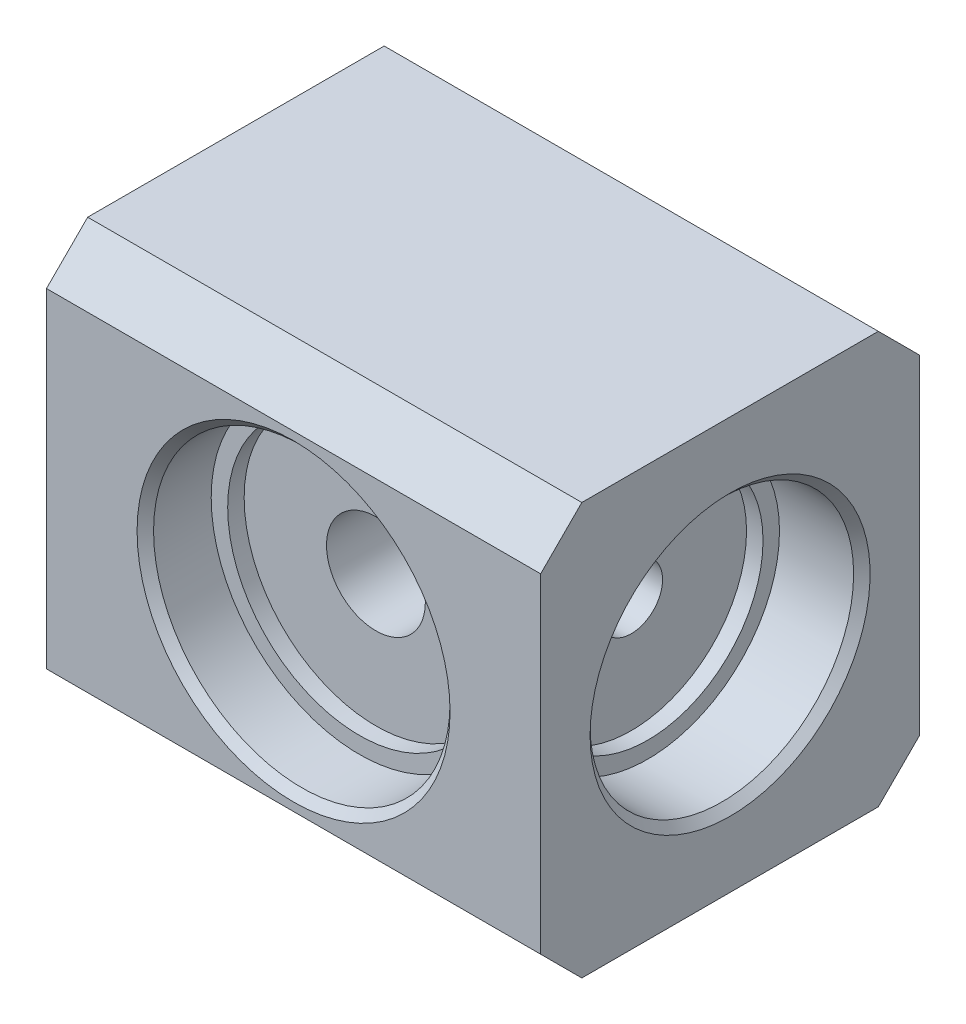
from build123d import *

# Parameters (mm, degrees)
SKETCH1_W           = 30
SKETCH1_H           = 23
BOSS_EXTRUDE1_DEPTH = 25
SKETCH2_R           = 8
CUT_EXTRUDE1_DEPTH  = 5
SKETCH3_R           = 7
CUT_EXTRUDE2_DEPTH  = 1
SKETCH4_R           = 1.9
CUT_EXTRUDE3_DEPTH  = 4
SKETCH6_R           = 9
CUT_EXTRUDE4_DEPTH  = 4
SKETCH7_R           = 3
CUT_EXTRUDE8_DEPTH  = 19
SKETCH12_R          = 8
CUT_EXTRUDE9_DEPTH  = 1
CHAMFER1_SIZE       = 2.5
CHAMFER2_SIZE       = 0.5


with BuildPart() as part:
    # Sketch1 → Boss-Extrude1 (new body)
    with BuildSketch(Plane(origin=(0, 0, 0), x_dir=(1, 0, 0), z_dir=(0, 1, 0))):
        with Locations((15, 1)):
            Rectangle(SKETCH1_W, SKETCH1_H)
    extrude(amount=BOSS_EXTRUDE1_DEPTH)

    # Sketch2 → Cut-Extrude1 (cut)
    with BuildSketch(Plane(origin=(30, 0, 0), x_dir=(0, 0, -1), z_dir=(1, 0, 0))):
        with Locations((1, 12.5)):
            Circle(SKETCH2_R)
    cut_extrude1 = extrude(amount=-CUT_EXTRUDE1_DEPTH, mode=Mode.SUBTRACT)

    # Sketch3 → Cut-Extrude2 (cut)
    with BuildSketch(Plane(origin=(25, 0, 0), x_dir=(0, 0, -1), z_dir=(1, 0, 0))):
        with Locations((1, 12.5)):
            Circle(SKETCH3_R)
    cut_extrude2 = extrude(amount=-CUT_EXTRUDE2_DEPTH, mode=Mode.SUBTRACT)

    # Sketch4 → Cut-Extrude3 (cut)
    with BuildSketch(Plane(origin=(24, 0, 0), x_dir=(0, 0, -1), z_dir=(1, 0, 0))):
        with Locations((1, 12.5)):
            Circle(SKETCH4_R)
    cut_extrude3 = extrude(amount=-CUT_EXTRUDE3_DEPTH, mode=Mode.SUBTRACT)

    # Mirror1: Cut-Extrude1, Cut-Extrude2, Cut-Extrude3 across plane
    add(cut_extrude1.mirror(Plane(origin=(15, 25, 0), x_dir=(0, 0, 1), z_dir=(1, 0, 0))), mode=Mode.SUBTRACT)
    add(cut_extrude2.mirror(Plane(origin=(15, 25, 0), x_dir=(0, 0, 1), z_dir=(1, 0, 0))), mode=Mode.SUBTRACT)
    add(cut_extrude3.mirror(Plane(origin=(15, 25, 0), x_dir=(0, 0, 1), z_dir=(1, 0, 0))), mode=Mode.SUBTRACT)

    # Sketch6 → Cut-Extrude4 (cut)
    with BuildSketch(Plane.XY.offset(10.5)):
        with Locations((15, 12.5)):
            Circle(SKETCH6_R)
    cut_extrude4 = extrude(amount=-CUT_EXTRUDE4_DEPTH, mode=Mode.SUBTRACT)

    # Sketch7 → Cut-Extrude8 (cut)
    with BuildSketch(Plane.XY.offset(6.5)):
        with Locations((15, 12.5)):
            Circle(SKETCH7_R)
    extrude(amount=-CUT_EXTRUDE8_DEPTH, mode=Mode.SUBTRACT)

    # Sketch12 → Cut-Extrude9 (cut)
    with BuildSketch(Plane.XY.offset(6.5)):
        with Locations((15, 12.5)):
            Circle(SKETCH12_R)
    cut_extrude9 = extrude(amount=-CUT_EXTRUDE9_DEPTH, mode=Mode.SUBTRACT)

    # Mirror4: Cut-Extrude4, Cut-Extrude9 across plane
    add(cut_extrude4.mirror(Plane(origin=(15, 0, -1), x_dir=(1, 0, 0), z_dir=(0, 0, 1))), mode=Mode.SUBTRACT)
    add(cut_extrude9.mirror(Plane(origin=(15, 0, -1), x_dir=(1, 0, 0), z_dir=(0, 0, 1))), mode=Mode.SUBTRACT)

    # Chamfer1
    chamfer1_edges = [part.edges().sort_by_distance(p)[0] for p in [
        (15, 25, -12.5),
        (15, 0, -12.5),
        (15, 0, 10.5),
        (15, 25, 10.5),
    ]]
    chamfer(chamfer1_edges, length=CHAMFER1_SIZE)

    # Chamfer2
    chamfer2_edges = [part.edges().sort_by_distance(p)[0] for p in [
        (30, 12.5, 7),
        (0, 12.5, 7),
        (6, 12.5, 10.5),
        (6, 12.5, -12.5),
    ]]
    chamfer(chamfer2_edges, length=CHAMFER2_SIZE)


solid = part.part
